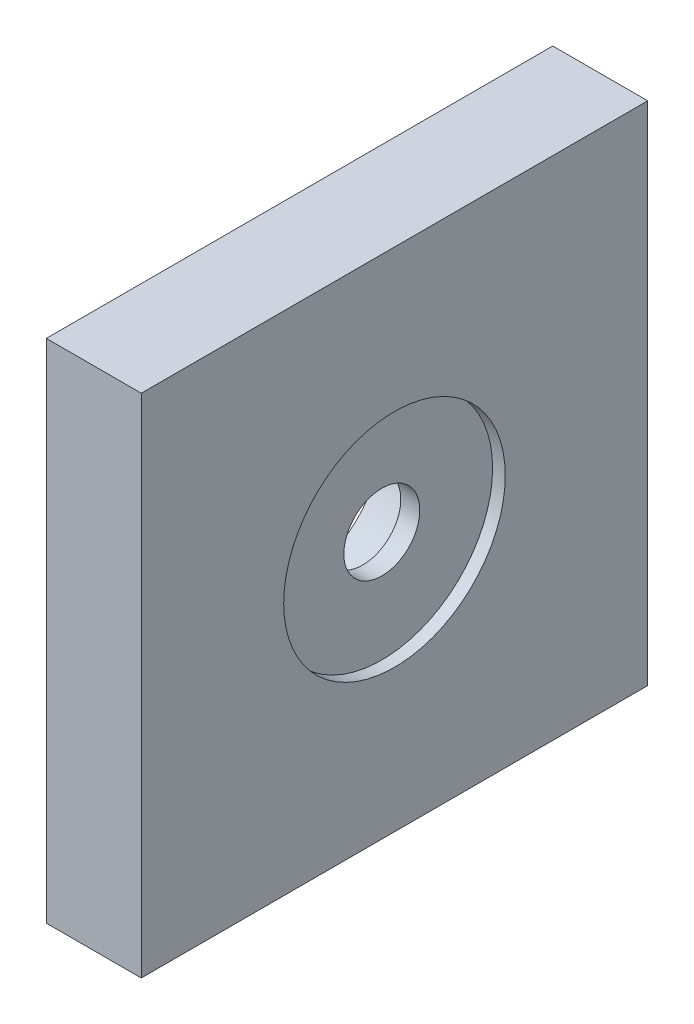
from build123d import *

# Parameters (mm, degrees)
SKETCH_1_W      = 80
SKETCH_1_H      = 80
EXTRUDE_1_DEPTH = 15


with BuildPart() as part:
    # Эскиз1 → Бобышка-Вытянуть1 (new body)
    with BuildSketch(Plane(origin=(0, 0, 0), x_dir=(0, -1, 0), z_dir=(-1, 0, 0))):
        with Locations((-40, 40)):
            Rectangle(SKETCH_1_W, SKETCH_1_H)
    extrude(amount=-EXTRUDE_1_DEPTH)

    # Эскиз2 → Вырез-Повернуть1 (revolve, cut)
    with BuildSketch(Plane(origin=(0, 0, 40), x_dir=(-1, 0, 0), z_dir=(0, 0, -1)), mode=Mode.PRIVATE) as cut_revolve_1_sk:
        Polygon((-15, 57.5), (-15, 40), (0, 40), (0, 53), (-10, 53), (-10, 46), (-13, 46), (-13, 57.5), align=None)
    revolve(cut_revolve_1_sk.sketch.rotate(Axis((15, 40, 40), (-1, 0, 0)), 270), axis=Axis((15, 40, 40), (-1, 0, 0)), mode=Mode.SUBTRACT)


solid = part.part
